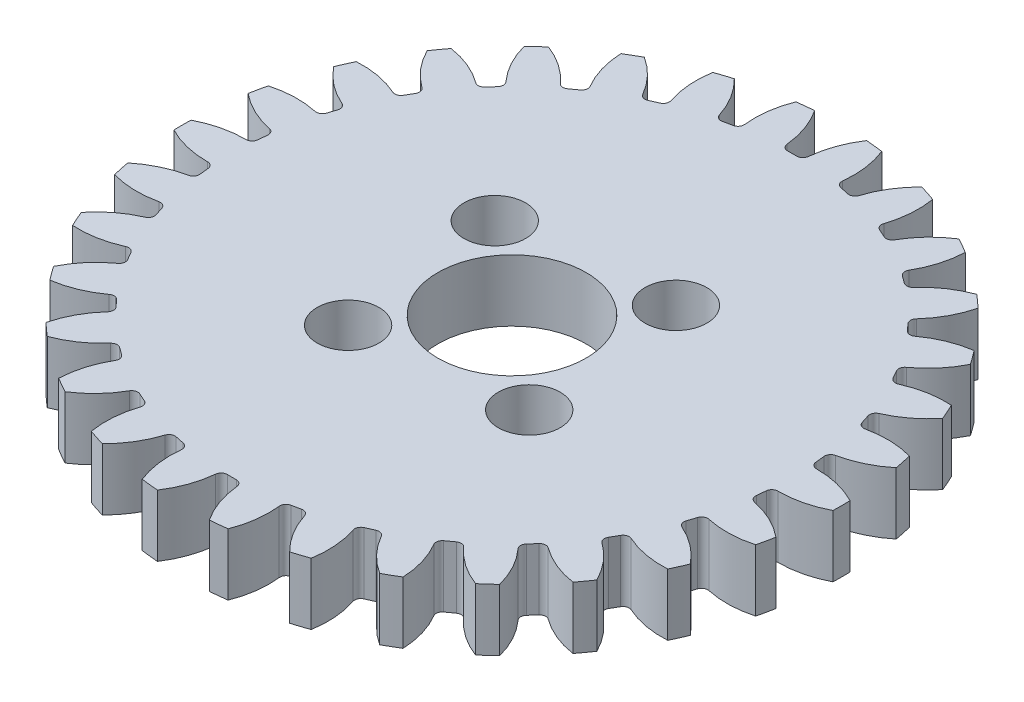
from build123d import *

# Parameters (mm, degrees)
CROQUIS1_R              = 1.5
CROQUIS1_R_2            = 3.6
SALIENTE_EXTRUIR1_DEPTH = 3


with BuildPart() as part:
    # Croquis1 → Saliente-Extruir1 (new body)
    with BuildSketch(Plane(origin=(0, 0, 0), x_dir=(1, 0, 0), z_dir=(0, 1, 0))):
        with BuildLine():
            Line((0.219874756, 13.6), (-0.219874756, 13.6))
            ThreePointArc((-0.219874756, 13.6), (-0.421386888, 13.677754953), (-0.518441911, 13.870714262))
            ThreePointArc((-0.518441911, 13.870714262), (-0.761174374, 14.956054767), (-1.259418951, 15.950356231))
            ThreePointArc((-1.259418951, 15.950356231), (-1.672455412, 15.912350326), (-2.084367907, 15.863650602))
            ThreePointArc((-2.084367907, 15.863650602), (-2.364997747, 14.787486138), (-2.376770944, 13.67539601))
            ThreePointArc((-2.376770944, 13.67539601), (-2.431586585, 13.466474451), (-2.61252903, 13.348521902))
            Line((-2.61252903, 13.348521902), (-3.042668961, 13.257092838))
            ThreePointArc((-3.042668961, 13.257092838), (-3.255943733, 13.291251931), (-3.390996366, 13.459815741))
            ThreePointArc((-3.390996366, 13.459815741), (-3.854079522, 14.470972036), (-4.548163159, 15.339954755))
            ThreePointArc((-4.548163159, 15.339954755), (-4.94427191, 15.216904261), (-5.337057887, 15.083627319))
            ThreePointArc((-5.337057887, 15.083627319), (-5.387808118, 13.972633406), (-5.168107503, 12.88239733))
            ThreePointArc((-5.168107503, 12.88239733), (-5.178288057, 12.666644397), (-5.330752761, 12.513649344))
            Line((-5.330752761, 12.513649344), (-5.732483931, 12.334787104))
            ThreePointArc((-5.732483931, 12.334787104), (-5.948200212, 12.32385742), (-6.115348008, 12.460658686))
            ThreePointArc((-6.115348008, 12.460658686), (-6.778542901, 13.353438387), (-7.638130812, 14.059123646))
            ThreePointArc((-7.638130812, 14.059123646), (-8, 13.856406461), (-8.356492827, 13.644377144))
            ThreePointArc((-8.356492827, 13.644377144), (-8.17514542, 12.547109547), (-7.733572966, 11.526376071))
            ThreePointArc((-7.733572966, 11.526376071), (-7.698673492, 11.313221201), (-7.815997017, 11.131870263))
            Line((-7.815997017, 11.131870263), (-8.171761846, 10.873391984))
            ThreePointArc((-8.171761846, 10.873391984), (-8.3804918, 10.817851204), (-8.572429598, 10.916911053))
            ThreePointArc((-8.572429598, 10.916911053), (-9.406751429, 11.652295404), (-10.394275496, 12.163841371))
            ThreePointArc((-10.394275496, 12.163841371), (-10.706089702, 11.890317208), (-11.010708931, 11.608802214))
            ThreePointArc((-11.010708931, 11.608802214), (-10.605189639, 10.573216792), (-9.961044179, 9.666596868))
            ThreePointArc((-9.961044179, 9.666596868), (-9.882589954, 9.465355951), (-9.959644697, 9.263575034))
            Line((-9.959644697, 9.263575034), (-10.253894556, 8.936777459))
            ThreePointArc((-10.253894556, 8.936777459), (-10.446515682, 8.83905298), (-10.654854879, 8.896042021))
            ThreePointArc((-10.654854879, 8.896042021), (-11.62383978, 9.441891198), (-12.696140464, 9.73694086))
            ThreePointArc((-12.696140464, 9.73694086), (-12.94427191, 9.404564037), (-13.18370422, 9.065866922))
            ThreePointArc((-13.18370422, 9.065866922), (-12.571736181, 8.137223728), (-11.753169964, 7.384340996))
            ThreePointArc((-11.753169964, 7.384340996), (-11.634589812, 7.203809227), (-11.668008113, 6.990417125))
            Line((-11.668008113, 6.990417125), (-11.88788287, 6.609582875))
            ThreePointArc((-11.88788287, 6.609582875), (-12.0559767, 6.473945727), (-12.271611875, 6.486373266))
            ThreePointArc((-12.271611875, 6.486373266), (-13.332910556, 6.818831039), (-14.443123171, 6.88448931))
            ThreePointArc((-14.443123171, 6.88448931), (-14.616727322, 6.507786289), (-14.780508372, 6.126709742))
            ThreePointArc((-14.780508372, 6.126709742), (-13.988837527, 5.34559494), (-13.031625823, 4.779353988))
            ThreePointArc((-13.031625823, 4.779353988), (-12.878102267, 4.627421471), (-12.866423585, 4.411744443))
            Line((-12.866423585, 4.411744443), (-13.002313658, 3.993517804))
            ThreePointArc((-13.002313658, 3.993517804), (-13.138533686, 3.82589598), (-13.352040545, 3.793218874))
            ThreePointArc((-13.352040545, 3.793218874), (-14.459269161, 3.897755243), (-15.55887209, 3.731152541))
            ThreePointArc((-15.55887209, 3.731152541), (-15.650361612, 3.326587053), (-15.731333383, 2.919785948))
            ThreePointArc((-15.731333383, 2.919785948), (-14.794559546, 2.320338003), (-13.740537101, 1.965486278))
            ThreePointArc((-13.740537101, 1.965486278), (-13.558779857, 1.848793193), (-13.502514607, 1.64025736))
            Line((-13.502514607, 1.64025736), (-13.548480947, 1.202916841))
            ThreePointArc((-13.548480947, 1.202916841), (-13.646873704, 1.010636219), (-13.848920974, 0.934282615))
            ThreePointArc((-13.848920974, 0.934282615), (-14.953688322, 0.80632884), (-15.994623639, 0.414746503))
            ThreePointArc((-15.994623639, 0.414746503), (-16, 0), (-15.994623639, -0.414746503))
            ThreePointArc((-15.994623639, -0.414746503), (-14.953688322, -0.80632884), (-13.848920974, -0.934282615))
            ThreePointArc((-13.848920974, -0.934282615), (-13.646873704, -1.010636219), (-13.548480947, -1.202916841))
            Line((-13.548480947, -1.202916841), (-13.502514607, -1.64025736))
            ThreePointArc((-13.502514607, -1.64025736), (-13.558779857, -1.848793193), (-13.740537101, -1.965486278))
            ThreePointArc((-13.740537101, -1.965486278), (-14.794559546, -2.320338003), (-15.731333383, -2.919785948))
            ThreePointArc((-15.731333383, -2.919785948), (-15.650361612, -3.326587053), (-15.55887209, -3.731152541))
            ThreePointArc((-15.55887209, -3.731152541), (-14.459269161, -3.897755243), (-13.352040545, -3.793218874))
            ThreePointArc((-13.352040545, -3.793218874), (-13.138533686, -3.82589598), (-13.002313658, -3.993517804))
            Line((-13.002313658, -3.993517804), (-12.866423585, -4.411744443))
            ThreePointArc((-12.866423585, -4.411744443), (-12.878102267, -4.627421471), (-13.031625823, -4.779353988))
            ThreePointArc((-13.031625823, -4.779353988), (-13.988837527, -5.34559494), (-14.780508372, -6.126709742))
            ThreePointArc((-14.780508372, -6.126709742), (-14.616727322, -6.507786289), (-14.443123171, -6.88448931))
            ThreePointArc((-14.443123171, -6.88448931), (-13.332910556, -6.818831039), (-12.271611875, -6.486373266))
            ThreePointArc((-12.271611875, -6.486373266), (-12.0559767, -6.473945727), (-11.88788287, -6.609582875))
            Line((-11.88788287, -6.609582875), (-11.668008113, -6.990417125))
            ThreePointArc((-11.668008113, -6.990417125), (-11.634589812, -7.203809227), (-11.753169964, -7.384340996))
            ThreePointArc((-11.753169964, -7.384340996), (-12.571736181, -8.137223728), (-13.18370422, -9.065866922))
            ThreePointArc((-13.18370422, -9.065866922), (-12.94427191, -9.404564037), (-12.696140464, -9.73694086))
            ThreePointArc((-12.696140464, -9.73694086), (-11.62383978, -9.441891198), (-10.654854879, -8.896042021))
            ThreePointArc((-10.654854879, -8.896042021), (-10.446515682, -8.83905298), (-10.253894556, -8.936777459))
            Line((-10.253894556, -8.936777459), (-9.959644697, -9.263575034))
            ThreePointArc((-9.959644697, -9.263575034), (-9.882589954, -9.465355951), (-9.961044179, -9.666596868))
            ThreePointArc((-9.961044179, -9.666596868), (-10.605189639, -10.573216792), (-11.010708931, -11.608802214))
            ThreePointArc((-11.010708931, -11.608802214), (-10.706089702, -11.890317208), (-10.394275496, -12.163841371))
            ThreePointArc((-10.394275496, -12.163841371), (-9.406751429, -11.652295404), (-8.572429598, -10.916911053))
            ThreePointArc((-8.572429598, -10.916911053), (-8.3804918, -10.817851204), (-8.171761846, -10.873391984))
            Line((-8.171761846, -10.873391984), (-7.815997017, -11.131870263))
            ThreePointArc((-7.815997017, -11.131870263), (-7.698673492, -11.313221201), (-7.733572966, -11.526376071))
            ThreePointArc((-7.733572966, -11.526376071), (-8.17514542, -12.547109547), (-8.356492827, -13.644377144))
            ThreePointArc((-8.356492827, -13.644377144), (-8, -13.856406461), (-7.638130812, -14.059123646))
            ThreePointArc((-7.638130812, -14.059123646), (-6.778542901, -13.353438387), (-6.115348008, -12.460658686))
            ThreePointArc((-6.115348008, -12.460658686), (-5.948200212, -12.32385742), (-5.732483931, -12.334787104))
            Line((-5.732483931, -12.334787104), (-5.330752761, -12.513649344))
            ThreePointArc((-5.330752761, -12.513649344), (-5.178288057, -12.666644397), (-5.168107503, -12.88239733))
            ThreePointArc((-5.168107503, -12.88239733), (-5.387808118, -13.972633406), (-5.337057887, -15.083627319))
            ThreePointArc((-5.337057887, -15.083627319), (-4.94427191, -15.216904261), (-4.548163159, -15.339954755))
            ThreePointArc((-4.548163159, -15.339954755), (-3.854079522, -14.470972036), (-3.390996366, -13.459815741))
            ThreePointArc((-3.390996366, -13.459815741), (-3.255943733, -13.291251931), (-3.042668961, -13.257092838))
            Line((-3.042668961, -13.257092838), (-2.61252903, -13.348521902))
            ThreePointArc((-2.61252903, -13.348521902), (-2.431586585, -13.466474451), (-2.376770944, -13.67539601))
            ThreePointArc((-2.376770944, -13.67539601), (-2.364997747, -14.787486138), (-2.084367907, -15.863650602))
            ThreePointArc((-2.084367907, -15.863650602), (-1.672455412, -15.912350326), (-1.259418951, -15.950356231))
            ThreePointArc((-1.259418951, -15.950356231), (-0.761174374, -14.956054767), (-0.518441911, -13.870714262))
            ThreePointArc((-0.518441911, -13.870714262), (-0.421386888, -13.677754953), (-0.219874756, -13.6))
            Line((-0.219874756, -13.6), (0.219874756, -13.6))
            ThreePointArc((0.219874756, -13.6), (0.421386888, -13.677754953), (0.518441911, -13.870714262))
            ThreePointArc((0.518441911, -13.870714262), (0.761174374, -14.956054767), (1.259418951, -15.950356231))
            ThreePointArc((1.259418951, -15.950356231), (1.672455412, -15.912350326), (2.084367907, -15.863650602))
            ThreePointArc((2.084367907, -15.863650602), (2.364997747, -14.787486138), (2.376770944, -13.67539601))
            ThreePointArc((2.376770944, -13.67539601), (2.431586585, -13.466474451), (2.61252903, -13.348521902))
            Line((2.61252903, -13.348521902), (3.042668961, -13.257092838))
            ThreePointArc((3.042668961, -13.257092838), (3.255943733, -13.291251931), (3.390996366, -13.459815741))
            ThreePointArc((3.390996366, -13.459815741), (3.854079522, -14.470972036), (4.548163159, -15.339954755))
            ThreePointArc((4.548163159, -15.339954755), (4.94427191, -15.216904261), (5.337057887, -15.083627319))
            ThreePointArc((5.337057887, -15.083627319), (5.387808118, -13.972633406), (5.168107503, -12.88239733))
            ThreePointArc((5.168107503, -12.88239733), (5.178288057, -12.666644397), (5.330752761, -12.513649344))
            Line((5.330752761, -12.513649344), (5.732483931, -12.334787104))
            ThreePointArc((5.732483931, -12.334787104), (5.948200212, -12.32385742), (6.115348008, -12.460658686))
            ThreePointArc((6.115348008, -12.460658686), (6.778542901, -13.353438387), (7.638130812, -14.059123646))
            ThreePointArc((7.638130812, -14.059123646), (8, -13.856406461), (8.356492827, -13.644377144))
            ThreePointArc((8.356492827, -13.644377144), (8.17514542, -12.547109547), (7.733572966, -11.526376071))
            ThreePointArc((7.733572966, -11.526376071), (7.698673492, -11.313221201), (7.815997017, -11.131870263))
            Line((7.815997017, -11.131870263), (8.171761846, -10.873391984))
            ThreePointArc((8.171761846, -10.873391984), (8.3804918, -10.817851204), (8.572429598, -10.916911053))
            ThreePointArc((8.572429598, -10.916911053), (9.406751429, -11.652295404), (10.394275496, -12.163841371))
            ThreePointArc((10.394275496, -12.163841371), (10.706089702, -11.890317208), (11.010708931, -11.608802214))
            ThreePointArc((11.010708931, -11.608802214), (10.605189639, -10.573216792), (9.961044179, -9.666596868))
            ThreePointArc((9.961044179, -9.666596868), (9.882589954, -9.465355951), (9.959644697, -9.263575034))
            Line((9.959644697, -9.263575034), (10.253894556, -8.936777459))
            ThreePointArc((10.253894556, -8.936777459), (10.446515682, -8.83905298), (10.654854879, -8.896042021))
            ThreePointArc((10.654854879, -8.896042021), (11.62383978, -9.441891198), (12.696140464, -9.73694086))
            ThreePointArc((12.696140464, -9.73694086), (12.94427191, -9.404564037), (13.18370422, -9.065866922))
            ThreePointArc((13.18370422, -9.065866922), (12.571736181, -8.137223728), (11.753169964, -7.384340996))
            ThreePointArc((11.753169964, -7.384340996), (11.634589812, -7.203809227), (11.668008113, -6.990417125))
            Line((11.668008113, -6.990417125), (11.88788287, -6.609582875))
            ThreePointArc((11.88788287, -6.609582875), (12.0559767, -6.473945727), (12.271611875, -6.486373266))
            ThreePointArc((12.271611875, -6.486373266), (13.332910556, -6.818831039), (14.443123171, -6.88448931))
            ThreePointArc((14.443123171, -6.88448931), (14.616727322, -6.507786289), (14.780508372, -6.126709742))
            ThreePointArc((14.780508372, -6.126709742), (13.988837527, -5.34559494), (13.031625823, -4.779353988))
            ThreePointArc((13.031625823, -4.779353988), (12.878102267, -4.627421471), (12.866423585, -4.411744443))
            Line((12.866423585, -4.411744443), (13.002313658, -3.993517804))
            ThreePointArc((13.002313658, -3.993517804), (13.138533686, -3.82589598), (13.352040545, -3.793218874))
            ThreePointArc((13.352040545, -3.793218874), (14.459269161, -3.897755243), (15.55887209, -3.731152541))
            ThreePointArc((15.55887209, -3.731152541), (15.650361612, -3.326587053), (15.731333383, -2.919785948))
            ThreePointArc((15.731333383, -2.919785948), (14.794559546, -2.320338003), (13.740537101, -1.965486278))
            ThreePointArc((13.740537101, -1.965486278), (13.558779857, -1.848793193), (13.502514607, -1.64025736))
            Line((13.502514607, -1.64025736), (13.548480947, -1.202916841))
            ThreePointArc((13.548480947, -1.202916841), (13.646873704, -1.010636219), (13.848920974, -0.934282615))
            ThreePointArc((13.848920974, -0.934282615), (14.953688322, -0.80632884), (15.994623639, -0.414746503))
            ThreePointArc((15.994623639, -0.414746503), (15.998655853, -0.207390674), (16, 0))
            ThreePointArc((16, 0), (15.998655853, 0.207390674), (15.994623639, 0.414746503))
            ThreePointArc((15.994623639, 0.414746503), (14.953688322, 0.80632884), (13.848920974, 0.934282615))
            ThreePointArc((13.848920974, 0.934282615), (13.646873704, 1.010636219), (13.548480947, 1.202916841))
            Line((13.548480947, 1.202916841), (13.502514607, 1.64025736))
            ThreePointArc((13.502514607, 1.64025736), (13.558779857, 1.848793193), (13.740537101, 1.965486278))
            ThreePointArc((13.740537101, 1.965486278), (14.794559546, 2.320338003), (15.731333383, 2.919785948))
            ThreePointArc((15.731333383, 2.919785948), (15.650361612, 3.326587053), (15.55887209, 3.731152541))
            ThreePointArc((15.55887209, 3.731152541), (14.459269161, 3.897755243), (13.352040545, 3.793218874))
            ThreePointArc((13.352040545, 3.793218874), (13.138533686, 3.82589598), (13.002313658, 3.993517804))
            Line((13.002313658, 3.993517804), (12.866423585, 4.411744443))
            ThreePointArc((12.866423585, 4.411744443), (12.878102267, 4.627421471), (13.031625823, 4.779353988))
            ThreePointArc((13.031625823, 4.779353988), (13.988837527, 5.34559494), (14.780508372, 6.126709742))
            ThreePointArc((14.780508372, 6.126709742), (14.616727322, 6.507786289), (14.443123171, 6.88448931))
            ThreePointArc((14.443123171, 6.88448931), (13.332910556, 6.818831039), (12.271611875, 6.486373266))
            ThreePointArc((12.271611875, 6.486373266), (12.0559767, 6.473945727), (11.88788287, 6.609582875))
            Line((11.88788287, 6.609582875), (11.668008113, 6.990417125))
            ThreePointArc((11.668008113, 6.990417125), (11.634589812, 7.203809227), (11.753169964, 7.384340996))
            ThreePointArc((11.753169964, 7.384340996), (12.571736181, 8.137223728), (13.18370422, 9.065866922))
            ThreePointArc((13.18370422, 9.065866922), (12.94427191, 9.404564037), (12.696140464, 9.73694086))
            ThreePointArc((12.696140464, 9.73694086), (11.62383978, 9.441891198), (10.654854879, 8.896042021))
            ThreePointArc((10.654854879, 8.896042021), (10.446515682, 8.83905298), (10.253894556, 8.936777459))
            Line((10.253894556, 8.936777459), (9.959644697, 9.263575034))
            ThreePointArc((9.959644697, 9.263575034), (9.882589954, 9.465355951), (9.961044179, 9.666596868))
            ThreePointArc((9.961044179, 9.666596868), (10.605189639, 10.573216792), (11.010708931, 11.608802214))
            ThreePointArc((11.010708931, 11.608802214), (10.706089702, 11.890317208), (10.394275496, 12.163841371))
            ThreePointArc((10.394275496, 12.163841371), (9.406751429, 11.652295404), (8.572429598, 10.916911053))
            ThreePointArc((8.572429598, 10.916911053), (8.3804918, 10.817851204), (8.171761846, 10.873391984))
            Line((8.171761846, 10.873391984), (7.815997017, 11.131870263))
            ThreePointArc((7.815997017, 11.131870263), (7.698673492, 11.313221201), (7.733572966, 11.526376071))
            ThreePointArc((7.733572966, 11.526376071), (8.17514542, 12.547109547), (8.356492827, 13.644377144))
            ThreePointArc((8.356492827, 13.644377144), (8, 13.856406461), (7.638130812, 14.059123646))
            ThreePointArc((7.638130812, 14.059123646), (6.778542901, 13.353438387), (6.115348008, 12.460658686))
            ThreePointArc((6.115348008, 12.460658686), (5.948200212, 12.32385742), (5.732483931, 12.334787104))
            Line((5.732483931, 12.334787104), (5.330752761, 12.513649344))
            ThreePointArc((5.330752761, 12.513649344), (5.178288057, 12.666644397), (5.168107503, 12.88239733))
            ThreePointArc((5.168107503, 12.88239733), (5.387808118, 13.972633406), (5.337057887, 15.083627319))
            ThreePointArc((5.337057887, 15.083627319), (4.94427191, 15.216904261), (4.548163159, 15.339954755))
            ThreePointArc((4.548163159, 15.339954755), (3.854079522, 14.470972036), (3.390996366, 13.459815741))
            ThreePointArc((3.390996366, 13.459815741), (3.255943733, 13.291251931), (3.042668961, 13.257092838))
            Line((3.042668961, 13.257092838), (2.61252903, 13.348521902))
            ThreePointArc((2.61252903, 13.348521902), (2.431586585, 13.466474451), (2.376770944, 13.67539601))
            ThreePointArc((2.376770944, 13.67539601), (2.364997747, 14.787486138), (2.084367907, 15.863650602))
            ThreePointArc((2.084367907, 15.863650602), (1.672455412, 15.912350326), (1.259418951, 15.950356231))
            ThreePointArc((1.259418951, 15.950356231), (0.761174374, 14.956054767), (0.518441911, 13.870714262))
            ThreePointArc((0.518441911, 13.870714262), (0.421386888, 13.677754953), (0.219874756, 13.6))
        make_face()
        with Locations(Location((-3.559973728, -4.396201435, 0), (0, 0, 270))):
            Circle(CROQUIS1_R, mode=Mode.SUBTRACT)
        with Locations(Location((4.396201435, -3.559973728, 0), (0, 0, 270))):
            Circle(CROQUIS1_R, mode=Mode.SUBTRACT)
        with Locations(Location((-4.396201435, 3.559973728, 0), (0, 0, 270))):
            Circle(CROQUIS1_R, mode=Mode.SUBTRACT)
        with Locations(Location((0, 0, 0), (0, 0, 270))):
            Circle(CROQUIS1_R_2, mode=Mode.SUBTRACT)
        with Locations(Location((3.559973728, 4.396201435, 0), (0, 0, 270))):
            Circle(CROQUIS1_R, mode=Mode.SUBTRACT)
    extrude(amount=SALIENTE_EXTRUIR1_DEPTH)


solid = part.part
